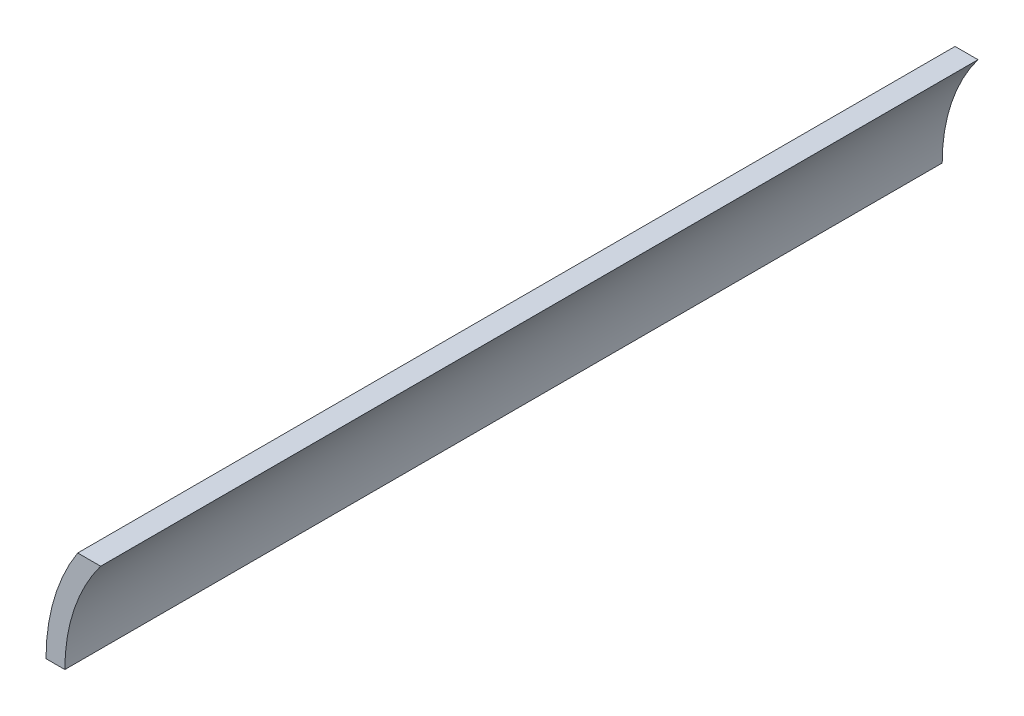
from build123d import *

# Parameters (mm, degrees)
BOSS_EXTRU_1_DEPTH = 245


with BuildPart() as part:
    # Esquisse1 → Boss.-Extru.1 (new body)
    with BuildSketch(Plane.XY):
        with BuildLine():
            Line((-46.40680681, 30), (-40, 30))
            ThreePointArc((-40, 30), (-47.434164903, 15.811388301), (-50, 0))
            Line((-50, 0), (-55.259313407, 0))
            ThreePointArc((-55.259313407, 0), (-53, 15.639428323), (-46.40680681, 30))
        make_face()
    extrude(amount=BOSS_EXTRU_1_DEPTH)


solid = part.part
